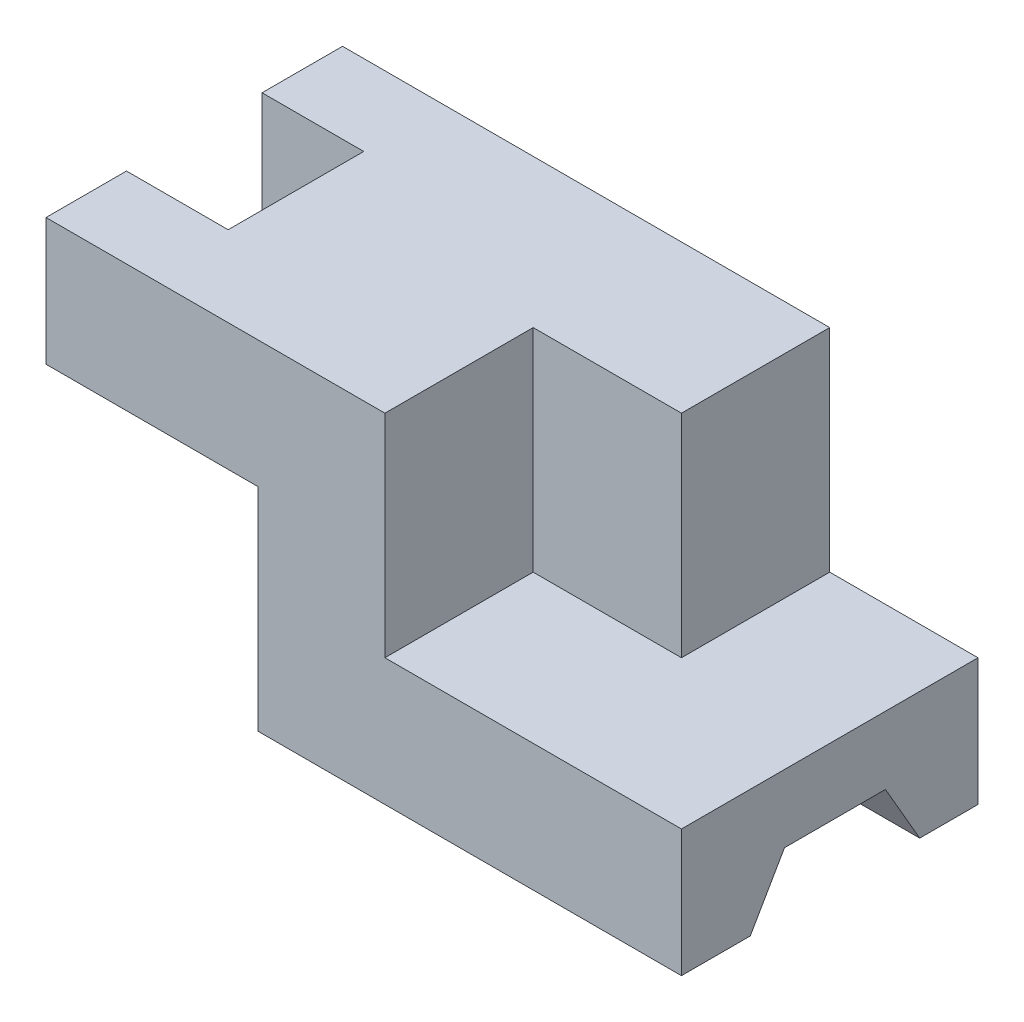
from build123d import *

# Parameters (mm, degrees)
BOSS_EXTRUDE1_DEPTH = 35
SKETCH3_W           = 12
SKETCH3_H           = 16
CUT_EXTRUDE1_DEPTH  = 35
BOSS_EXTRUDE2_REACH = 93.924
SKETCH4_W           = 17.5
SKETCH4_H           = 17.5
CUT_EXTRUDE2_DEPTH  = 92.923881554


with BuildPart() as part:
    # Sketch2 → Boss-Extrude1 (new body)
    with BuildSketch(Plane.XY):
        Polygon((25, 25), (25, 0), (75, 0), (75, 15), (40, 15), (40, 40), (0, 40), (0, 25), align=None)
    extrude(amount=BOSS_EXTRUDE1_DEPTH)

    # Sketch3 → Cut-Extrude1 (cut)
    with BuildSketch(Plane(origin=(0, 40, 0), x_dir=(1, 0, 0), z_dir=(0, 1, 0))):
        with Locations((6, -17.5)):
            Rectangle(SKETCH3_W, SKETCH3_H)
    extrude(amount=-CUT_EXTRUDE1_DEPTH, mode=Mode.SUBTRACT)

    # Sketch4 → Boss-Extrude2 (add, up to next)
    with BuildSketch(Plane(origin=(0, 40, 0), x_dir=(1, 0, 0), z_dir=(0, 1, 0)), mode=Mode.PRIVATE) as boss_extrude2_sk1:
        with Locations((48.75, -8.75)):
            Rectangle(SKETCH4_W, SKETCH4_H)
    boss_extrude2_tool1 = extrude(boss_extrude2_sk1.sketch, amount=-BOSS_EXTRUDE2_REACH, mode=Mode.PRIVATE) - part.part
    add(boss_extrude2_tool1.solids().sort_by_distance((48.75, 40, 8.75))[0])

    # Sketch5 → Cut-Extrude2 (cut, through all)
    with BuildSketch(Plane(origin=(75, 0, 0), x_dir=(0, 0, -1), z_dir=(1, 0, 0))):
        Polygon((-26.878944817, 0), (-22.837492933, 7), (-10.920396702, 7), (-6.878944817, 0), align=None)
    extrude(amount=-CUT_EXTRUDE2_DEPTH, mode=Mode.SUBTRACT)


solid = part.part
